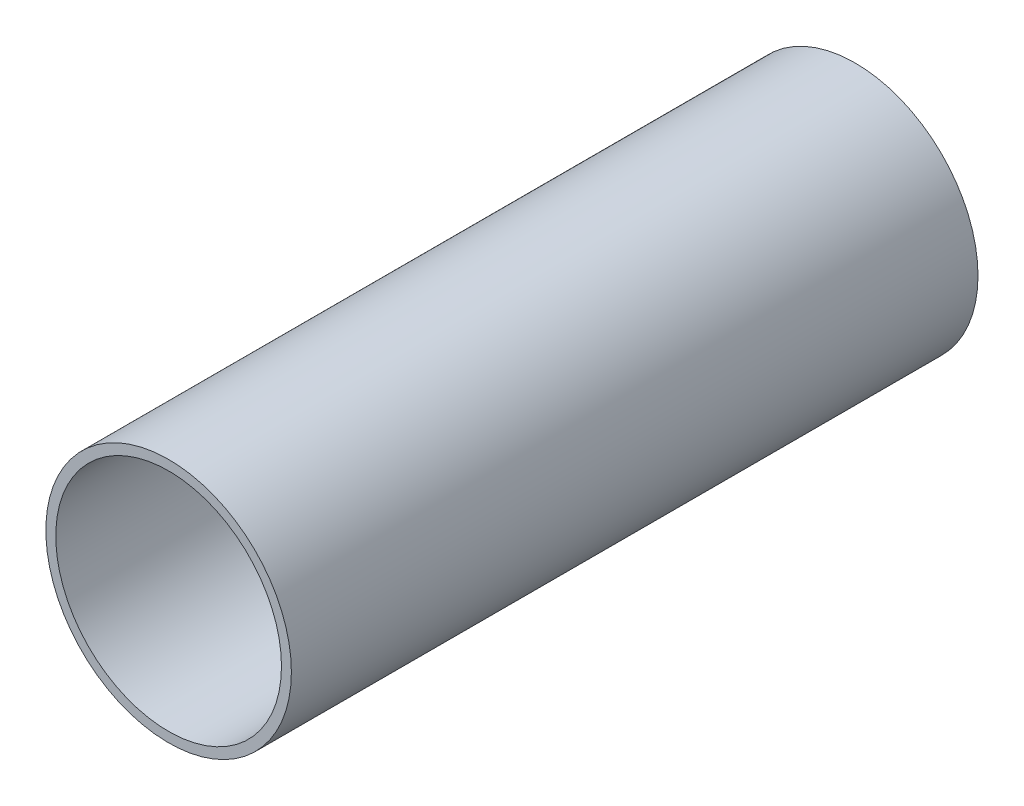
from build123d import *

# Parameters (mm, degrees)
SKETCH1_R           = 109
SKETCH1_R_2         = 100.2
BOSS_EXTRUDE1_DEPTH = 609.6


with BuildPart() as part:
    # Sketch1 → Boss-Extrude1 (new body)
    with BuildSketch(Plane.XY):
        Circle(SKETCH1_R)
        Circle(SKETCH1_R_2, mode=Mode.SUBTRACT)
    extrude(amount=BOSS_EXTRUDE1_DEPTH)


solid = part.part
